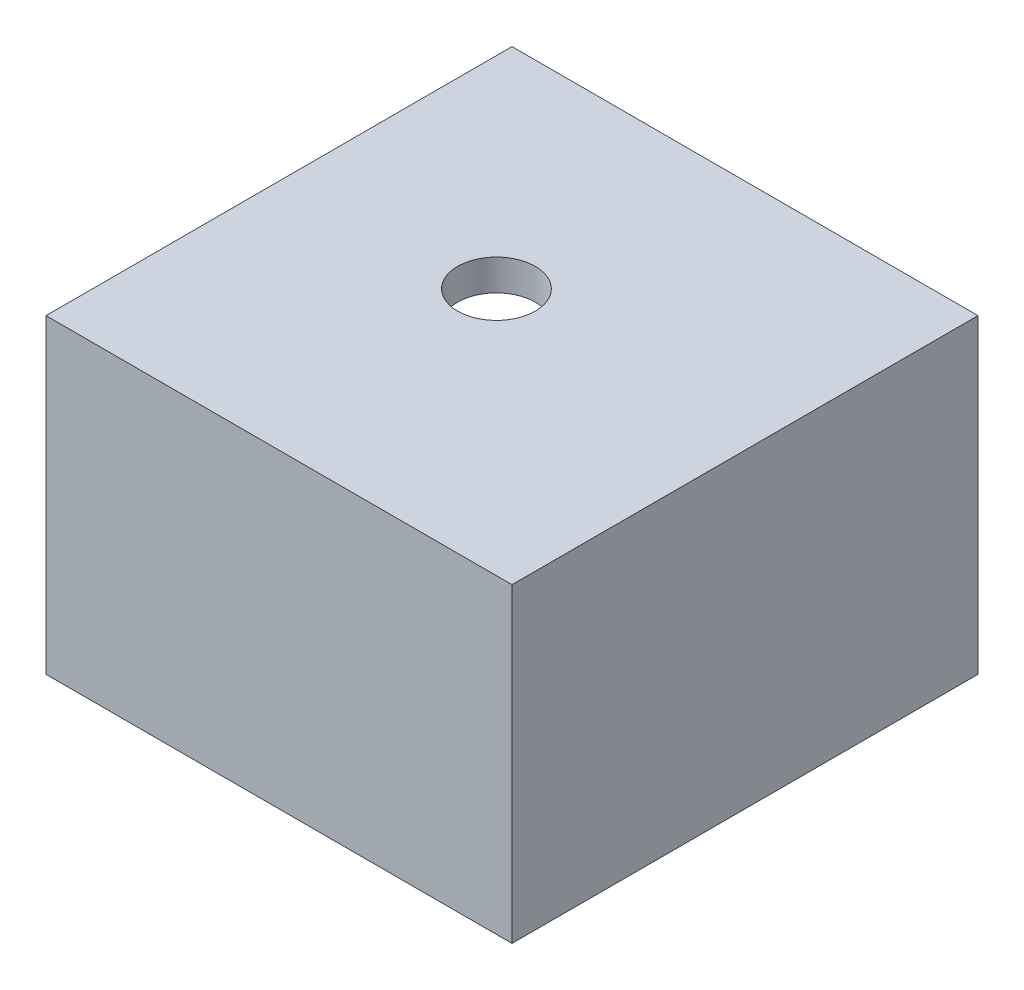
from build123d import *

# Parameters (mm, degrees)
SKETCH1_W               = 30
SKETCH1_H               = 30
BOSS_EXTRUDE1_DEPTH     = 10
SKETCH2_W               = 31
SKETCH2_H               = 31
SKETCH2_W_2             = 15
SKETCH2_H_2             = 15
CUT_EXTRUDE1_DEPTH      = 8
FILLET1_R               = 1
CUT_EXTRUDE2_DEPTH      = 28.820855486
CUT_EXTRUDE2_DEPTH_BACK = 28.820855486
SKETCH3_R               = 2.5


with BuildPart() as part:
    # Sketch1 → Boss-Extrude1 (new, symmetric)
    with BuildSketch(Plane(origin=(0, 0, 0), x_dir=(1, 0, 0), z_dir=(0, 1, 0))):
        Rectangle(SKETCH1_W, SKETCH1_H)
    extrude(amount=BOSS_EXTRUDE1_DEPTH, both=True)

    # Sketch2 → Cut-Extrude1 (cut, symmetric)
    # profile 1 of 3: a face of its own
    with BuildSketch(Plane(origin=(0, 0, 0), x_dir=(1, 0, 0), z_dir=(0, 1, 0))):
        with Locations((-7.5, 7.5)):
            Rectangle(SKETCH2_W, SKETCH2_H)
        with Locations((-7.5, 7.5)):
            Rectangle(SKETCH2_W_2, SKETCH2_H_2, mode=Mode.SUBTRACT)
    # profile 2 of 3: a face of its own
    with BuildSketch(Plane(origin=(0, 0, 0), x_dir=(1, 0, 0), z_dir=(0, 1, 0))):
        with Locations((-7.5, 7.5)):
            Rectangle(SKETCH2_W, SKETCH2_H)
        with Locations((-7.5, 7.5)):
            Rectangle(SKETCH2_W_2, SKETCH2_H_2, mode=Mode.SUBTRACT)
    # profile 3 of 3: a face of its own
    with BuildSketch(Plane(origin=(0, 0, 0), x_dir=(1, 0, 0), z_dir=(0, 1, 0))):
        with Locations((-7.5, 7.5)):
            Rectangle(SKETCH2_W_2, SKETCH2_H_2)
    extrude(amount=CUT_EXTRUDE1_DEPTH, both=True, mode=Mode.SUBTRACT)

    # Fillet1
    fillet1_edges = [part.edges().sort_by_distance(p)[0] for p in [
        (8, 0, 8),
    ]]
    fillet(fillet1_edges, radius=FILLET1_R)

    # Sketch3 → Cut-Extrude2 (cut, two sides: drawn at the far end of the back side and taken through both)
    with BuildSketch(Plane(origin=(0, -8, 0), x_dir=(1, 0, 0), z_dir=(0, 1, 0)).offset(-CUT_EXTRUDE2_DEPTH_BACK)):
        with Locations(Location((-2, 1, 0), (0, 0, 270))):
            Circle(SKETCH3_R)
    extrude(amount=CUT_EXTRUDE2_DEPTH + CUT_EXTRUDE2_DEPTH_BACK, mode=Mode.SUBTRACT)


solid = part.part
